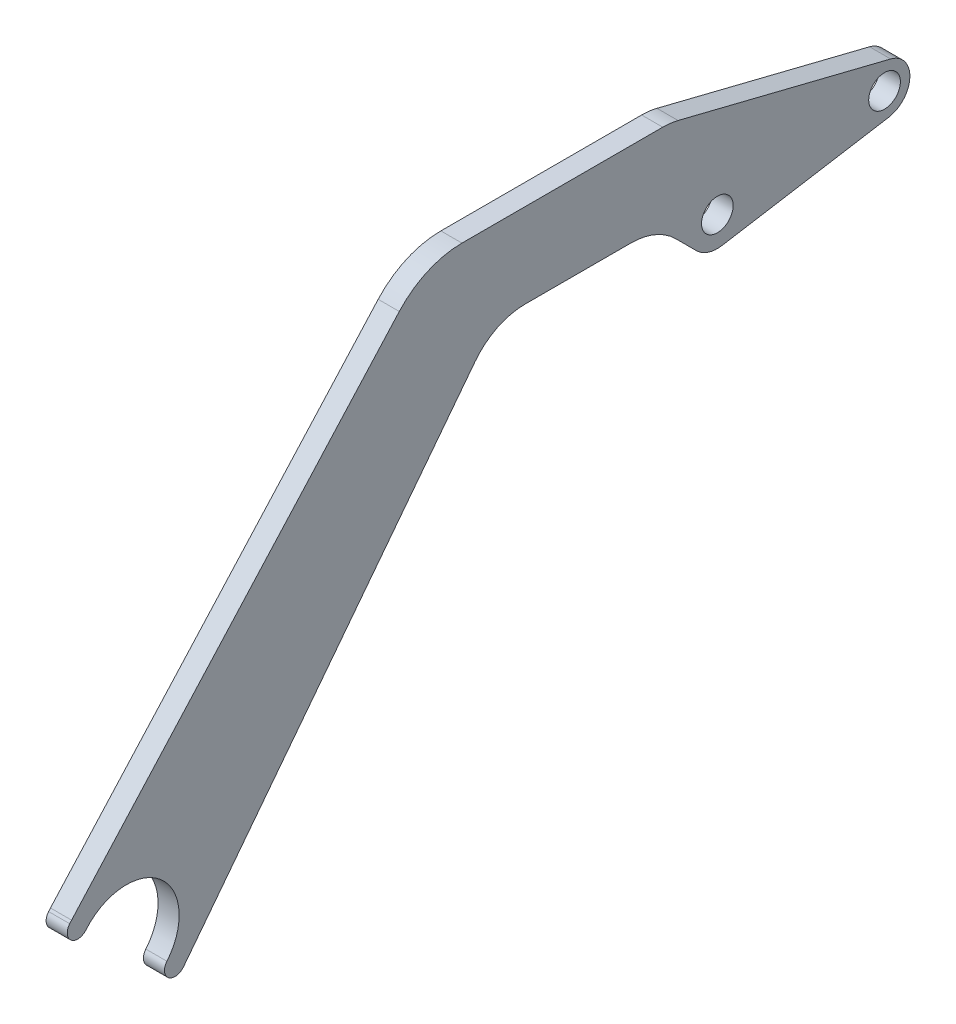
from build123d import *

# Parameters (mm, degrees)
SKETCH1_R           = 4.7625
BOSS_EXTRUDE1_DEPTH = 6.35


with BuildPart() as part:
    # Sketch1 → Boss-Extrude1 (new body)
    with BuildSketch(Plane(origin=(0, 0, 0), x_dir=(0, 0, -1), z_dir=(1, 0, 0))):
        with BuildLine():
            Line((1.456949245, -8.769800391), (51.554431531, -0.446978235))
            ThreePointArc((51.554431531, -0.446978235), (57.919565723, 6.766351601), (52.149062737, 14.463646963))
            Line((52.149062737, 14.463646963), (-11.823304022, 30.413749404))
            ThreePointArc((-11.823304022, 30.413749404), (-14.110305141, 30.837620007), (-16.431916133, 30.979615818))
            Line((-16.431916133, 30.979615818), (-76.842742751, 30.979615818))
            ThreePointArc((-76.842742751, 30.979615818), (-87.163314642, 28.788359771), (-95.703176645, 22.59267061))
            Line((-95.703176645, 22.59267061), (-194.302879657, -86.713577057))
            ThreePointArc((-194.302879657, -86.713577057), (-194.588070452, -87.035958133), (-194.866964637, -87.363801663))
            ThreePointArc((-194.866964637, -87.363801663), (-194.462569451, -91.835682088), (-189.990689026, -91.431286902))
            ThreePointArc((-189.990689026, -91.431286902), (-167.631286902, -89.409310974), (-165.609310974, -111.768713098))
            ThreePointArc((-165.609310974, -111.768713098), (-165.204915788, -116.240593522), (-160.733035363, -115.836198337))
            ThreePointArc((-160.733035363, -115.836198337), (-160.46054239, -115.503015314), (-160.194552833, -115.164617763))
            Line((-160.194552833, -115.164617763), (-72.883126037, -1.843568956))
            ThreePointArc((-72.883126037, -1.843568956), (-66.201418924, 3.623376815), (-57.792742751, 5.579615818))
            Line((-57.792742751, 5.579615818), (-26.042742751, 5.579615818))
            ThreePointArc((-26.042742751, 5.579615818), (-18.752623365, 4.129520913), (-12.572358569, 0))
            Line((-12.572358569, 0), (-6.286179285, -6.286179285))
            ThreePointArc((-6.286179285, -6.286179285), (-2.715227273, -8.465201761), (1.456949245, -8.769800391))
        make_face()
        Circle(SKETCH1_R, mode=Mode.SUBTRACT)
        with Locations((50.305617892, 7.069993529)):
            Circle(SKETCH1_R, mode=Mode.SUBTRACT)
    extrude(amount=BOSS_EXTRUDE1_DEPTH)


solid = part.part
